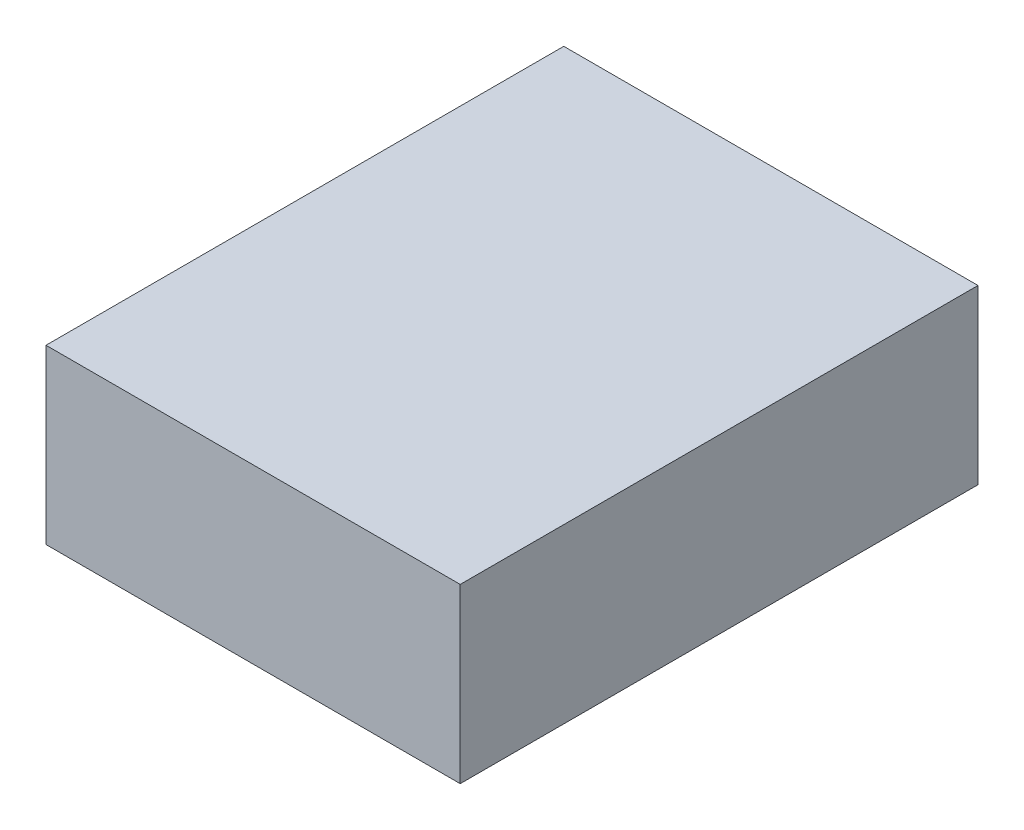
from build123d import *

# Parameters (mm, degrees)
SKETCH2_W           = 304.8
SKETCH2_H           = 381
BOSS_EXTRUDE1_DEPTH = 127


with BuildPart() as part:
    # Sketch2 → Boss-Extrude1 (new body)
    with BuildSketch(Plane(origin=(0, 0, 0), x_dir=(1, 0, 0), z_dir=(0, 1, 0))):
        with Locations((152.4, -190.5)):
            Rectangle(SKETCH2_W, SKETCH2_H)
    extrude(amount=BOSS_EXTRUDE1_DEPTH)


solid = part.part
